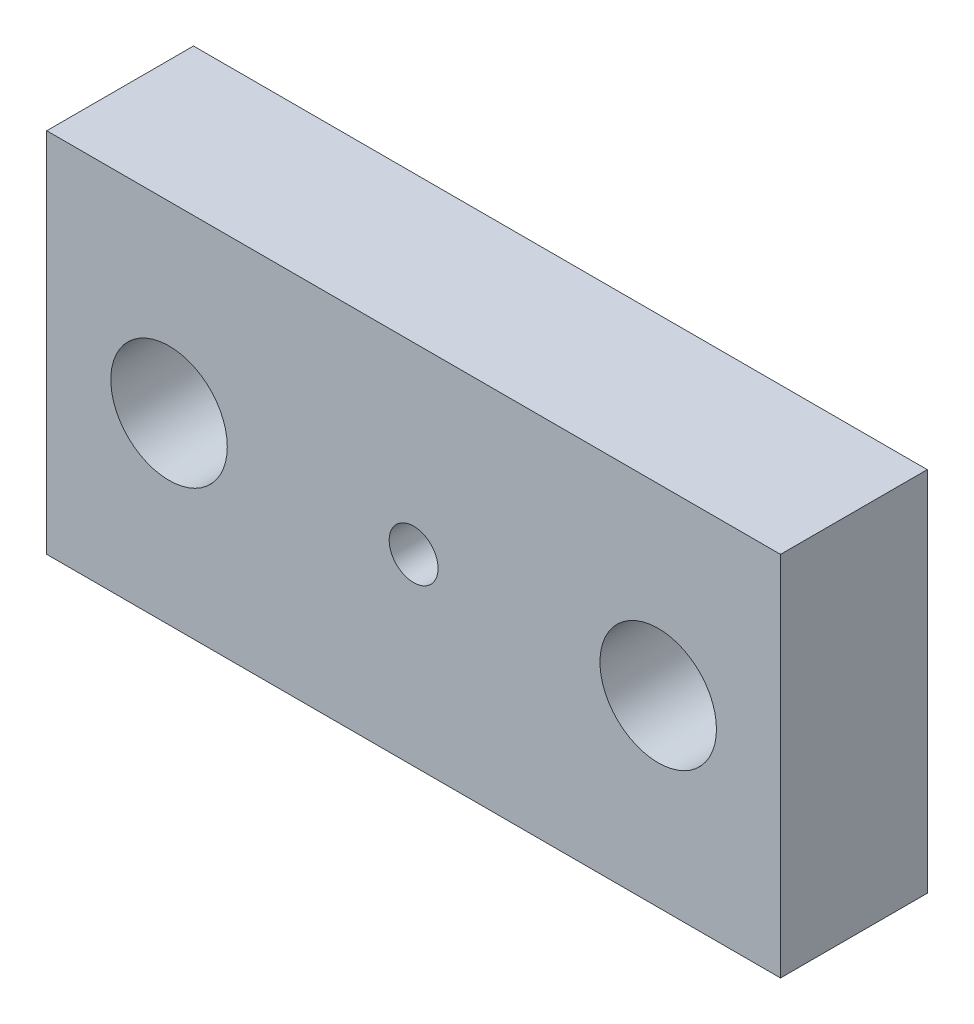
from build123d import *

# Parameters (mm, degrees)
SKETCH1_W           = 30
SKETCH1_H           = 15
SKETCH1_R           = 1
SKETCH1_R_2         = 2.38125
BOSS_EXTRUDE1_DEPTH = 6
SKETCH3_R           = 2.5
CUT_EXTRUDE2_DEPTH  = 3


with BuildPart() as part:
    # Sketch1 → Boss-Extrude1 (new body)
    with BuildSketch(Plane.XY):
        Rectangle(SKETCH1_W, SKETCH1_H)
        Circle(SKETCH1_R, mode=Mode.SUBTRACT)
        with Locations((10, 0)):
            Circle(SKETCH1_R_2, mode=Mode.SUBTRACT)
        with Locations((-10, 0)):
            Circle(SKETCH1_R_2, mode=Mode.SUBTRACT)
    extrude(amount=BOSS_EXTRUDE1_DEPTH)

    # Sketch3 → Cut-Extrude2 (cut)
    with BuildSketch(Plane(origin=(0, 0, 0), x_dir=(-1, 0, 0), z_dir=(0, 0, -1))):
        Circle(SKETCH3_R)
    extrude(amount=-CUT_EXTRUDE2_DEPTH, mode=Mode.SUBTRACT)


solid = part.part
